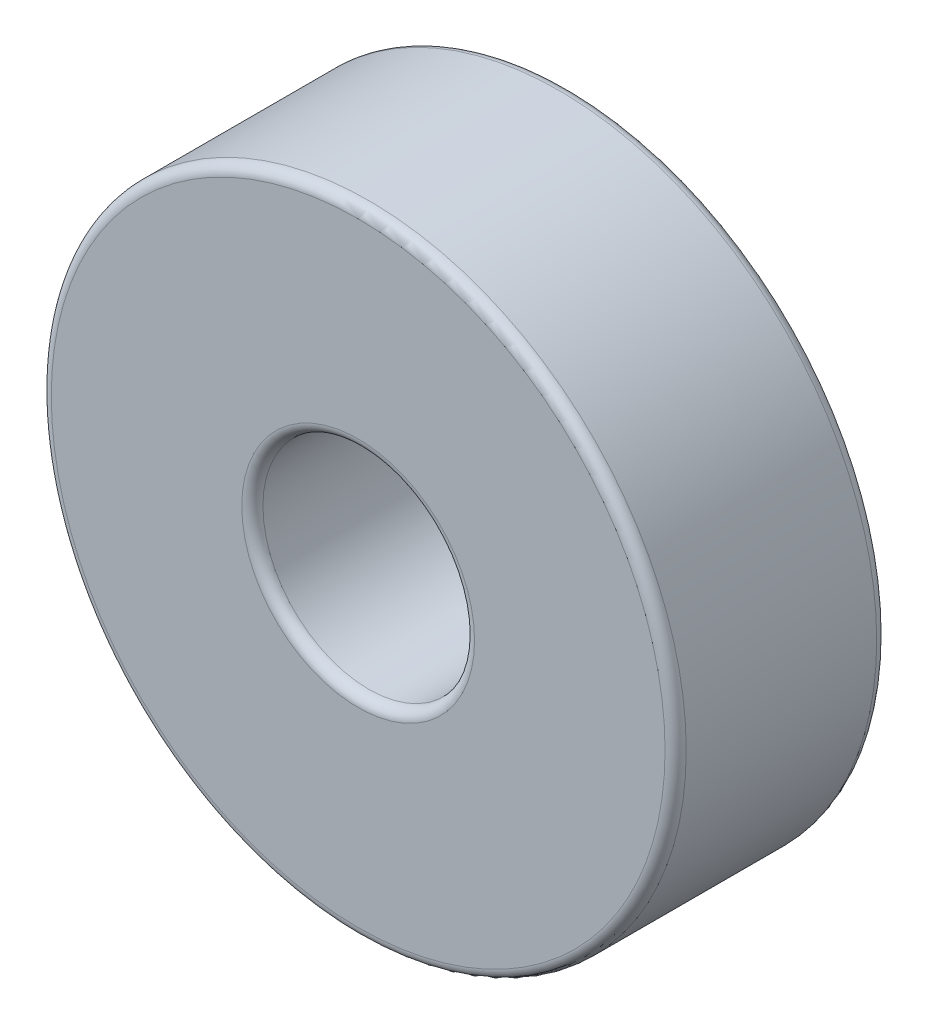
from build123d import *

# Parameters (mm, degrees)
SKETCH_1_R      = 4.5
SKETCH_1_R_2    = 1.5
EXTRUDE_1_DEPTH = 3
FILLET_1_R      = 0.15


with BuildPart() as part:
    # 草图1 → 凸台-拉伸1 (new body)
    with BuildSketch(Plane.XY):
        Circle(SKETCH_1_R)
        Circle(SKETCH_1_R_2, mode=Mode.SUBTRACT)
    extrude(amount=EXTRUDE_1_DEPTH)

    # 圆角1
    fillet_1_edges = [part.edges().sort_by_distance(p)[0] for p in [
        (-4.5, 0, 0),
        (-4.5, 0, 3),
        (-1.5, 0, 0),
        (-1.5, 0, 3),
    ]]
    fillet(fillet_1_edges, radius=FILLET_1_R)


solid = part.part
